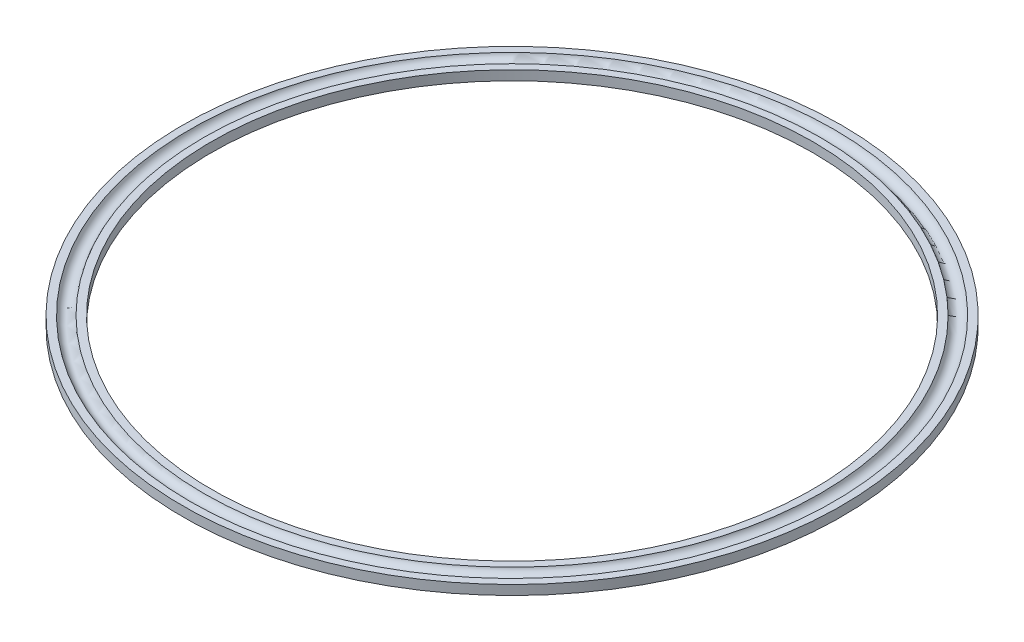
from build123d import *


with BuildPart() as part:
    # Sketch1 → Revolve1 (revolve)
    with BuildSketch(Plane.XY, mode=Mode.PRIVATE) as revolve1_sk:
        with BuildLine():
            Line((-100.0125, 0), (-109.5375, 0))
            Line((-109.5375, 0), (-109.5375, 3.175))
            Line((-109.5375, 3.175), (-107.070022127, 3.175))
            ThreePointArc((-107.070022127, 3.175), (-104.775, 1.42875), (-102.479977873, 3.175))
            Line((-102.479977873, 3.175), (-100.0125, 3.175))
            Line((-100.0125, 3.175), (-100.0125, 0))
        make_face()
    revolve(revolve1_sk.sketch.rotate(Axis((0, 0, 0), (0, 1, 0)), 270), axis=Axis((0, 0, 0), (0, 1, 0)))


solid = part.part
